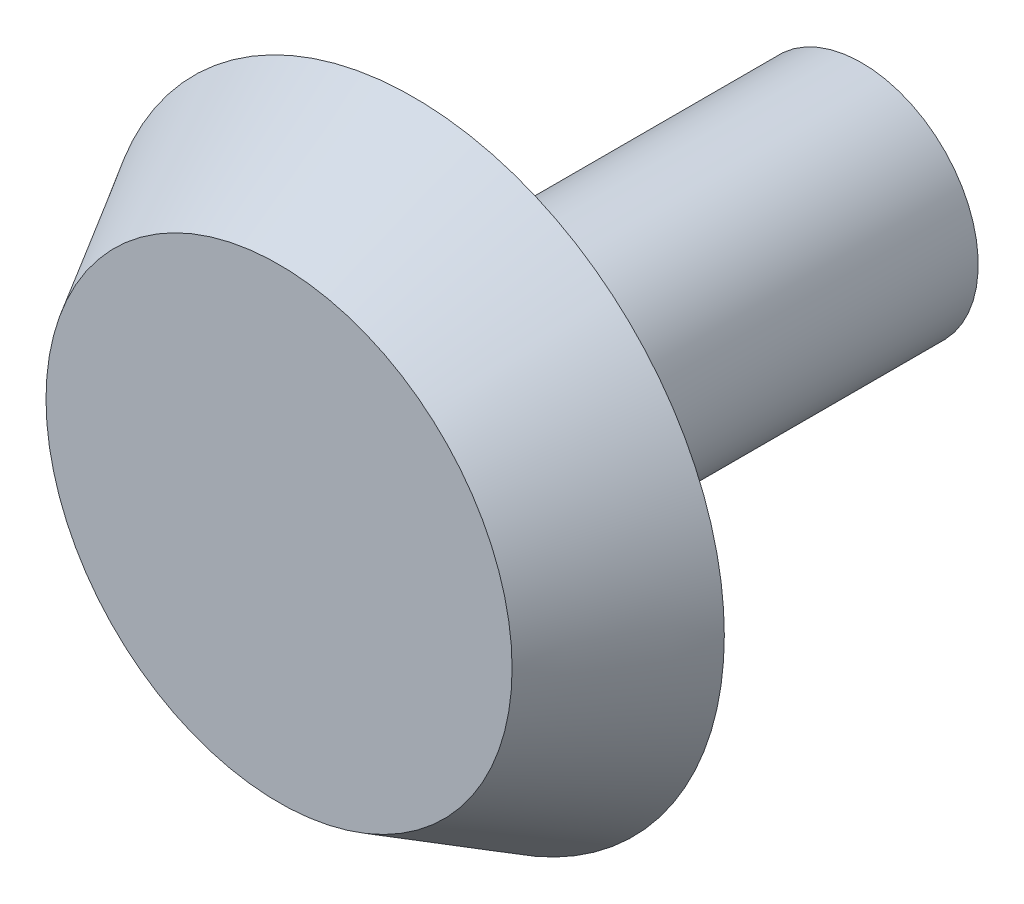
from build123d import *


with BuildPart() as part:
    # Sketch1 → Revolve1 (revolve)
    with BuildSketch(Plane(origin=(0, 0, 0), x_dir=(1, 0, 0), z_dir=(0, 1, 0)), mode=Mode.PRIVATE) as revolve1_sk:
        Polygon((0, 75), (15, 75), (15, 10), (30, 10), (40, 17.320508076), (30, 0), (0, 0), align=None)
    revolve(revolve1_sk.sketch.rotate(Axis((0, 0, -75), (0, 0, 1)), 180), axis=Axis((0, 0, -75), (0, 0, 1)))


solid = part.part
